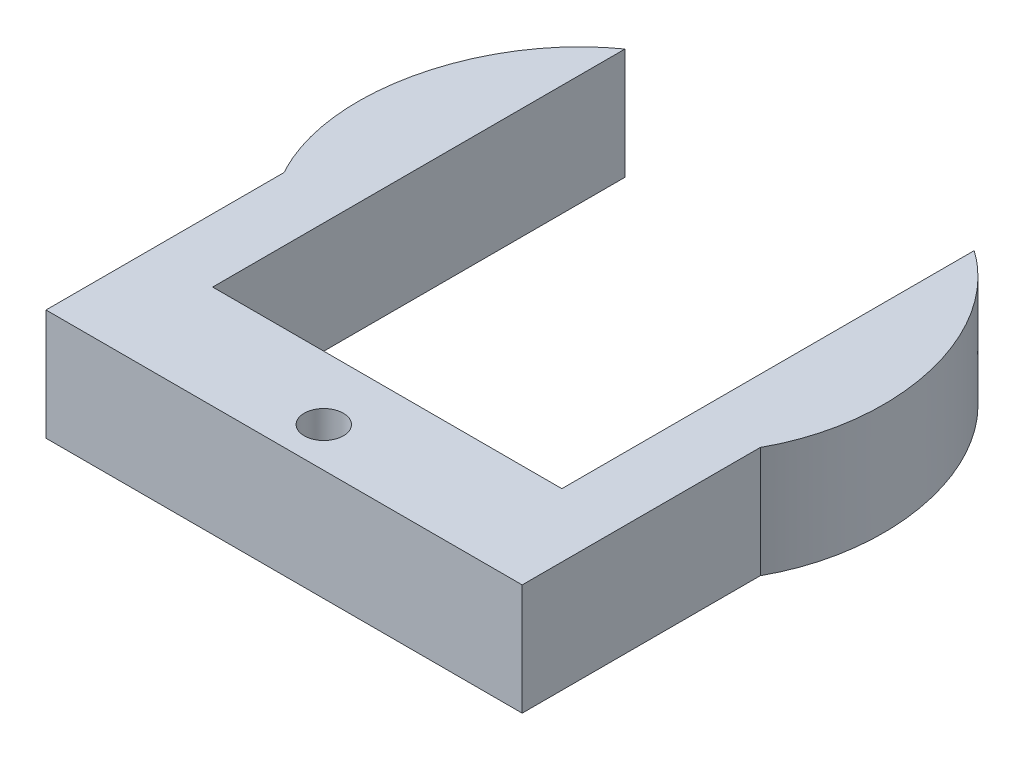
from build123d import *

# Parameters (mm, degrees)
BOSS_EXTRUDE1_DEPTH = 14
SKETCH3_R           = 2.469718116
CUT_EXTRUDE1_DEPTH  = 21


with BuildPart() as part:
    # Sketch1 → Boss-Extrude1 (new body)
    with BuildSketch(Plane(origin=(0, 0, 0), x_dir=(1, 0, 0), z_dir=(0, 1, 0))):
        with BuildLine():
            Line((8, 67.50149873), (8, 79.954057008))
            add(Edge.make_bspline(
                [(0, 45), (-4.267413412, 52.702157849), (-3.849710429, 67.232110416), (4.572220088, 77.524864833), (8, 79.954057008)],
                knots=[0, 0, 0, 0, 0.616858973, 0.90735247, 0.90735247, 0.90735247, 0.90735247], degree=3))
            Line((0, 45), (0, 15))
            Line((0, 15), (60, 15))
            Line((60, 15), (60, 28))
            Line((60, 28), (60, 45))
            add(Edge.make_bspline(
                [(60, 45), (64.267413412, 52.702157849), (63.849710429, 67.232110416), (55.427779912, 77.524864833), (52, 79.954057008)],
                knots=[0, 0, 0, 0, 0.616858973, 0.90735247, 0.90735247, 0.90735247, 0.90735247], degree=3))
            Line((52, 79.954057008), (52, 70.29729534))
            Line((52, 70.29729534), (52, 28))
            Line((52, 28), (8, 28))
            Line((8, 28), (8, 67.50149873))
        make_face()
    extrude(amount=BOSS_EXTRUDE1_DEPTH)

    # Sketch3 → Cut-Extrude1 (cut)
    with BuildSketch(Plane.XZ):
        with Locations(Location((30, -20, 0), (0, 0, 270))):
            Circle(SKETCH3_R)
    extrude(amount=-CUT_EXTRUDE1_DEPTH, mode=Mode.SUBTRACT)


solid = part.part
